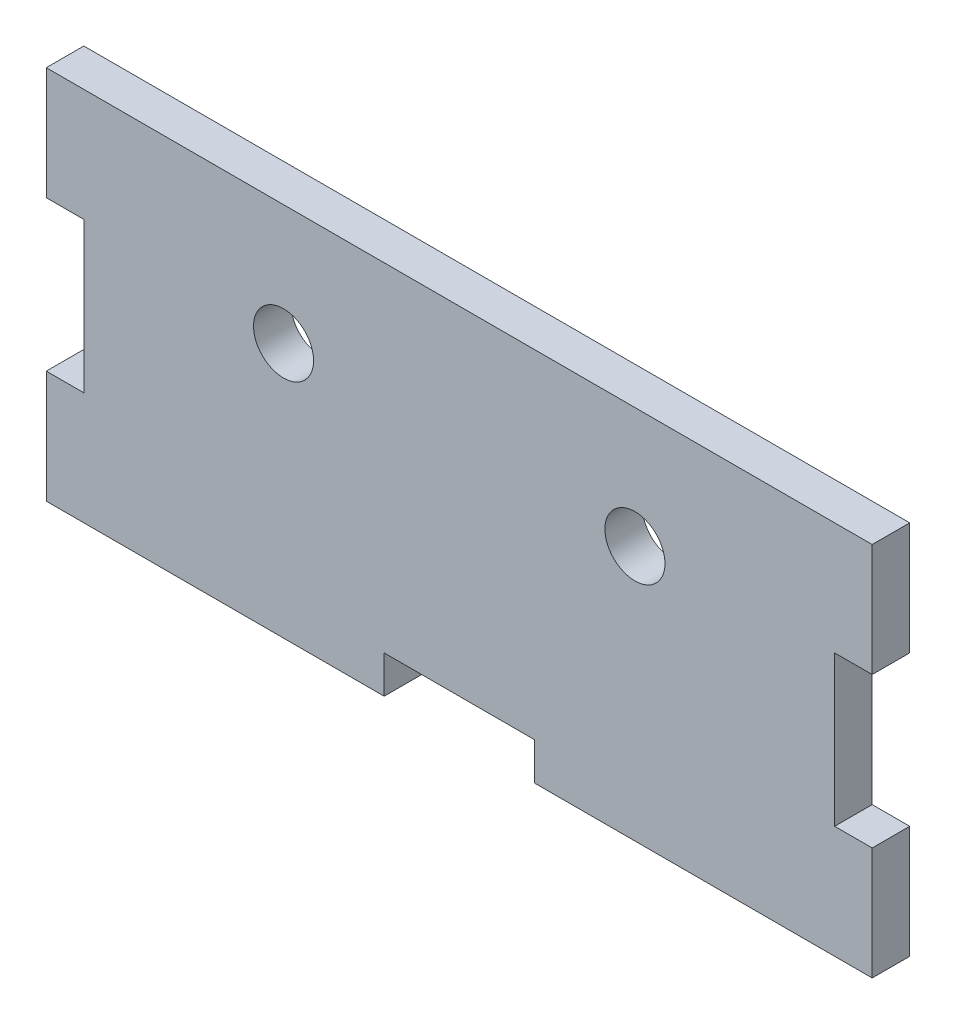
from build123d import *

# Parameters (mm, degrees)
SKETCH1_R           = 2.54
BOSS_EXTRUDE1_DEPTH = 3.175


with BuildPart() as part:
    # Sketch1 → Boss-Extrude1 (new body)
    with BuildSketch(Plane.XY):
        Polygon((0, 9.525), (0, 0), (28.575, 0), (28.575, 3.175), (41.275, 3.175), (41.275, 0), (69.85, 0), (69.85, 9.525), (66.675, 9.525), (66.675, 22.225), (69.85, 22.225), (69.85, 31.75), (0, 31.75), (0, 22.225), (3.175, 22.225), (3.175, 9.525), align=None)
        with Locations((20.066, 21.59)):
            Circle(SKETCH1_R, mode=Mode.SUBTRACT)
        with Locations((49.784, 21.59)):
            Circle(SKETCH1_R, mode=Mode.SUBTRACT)
    extrude(amount=BOSS_EXTRUDE1_DEPTH)


solid = part.part
